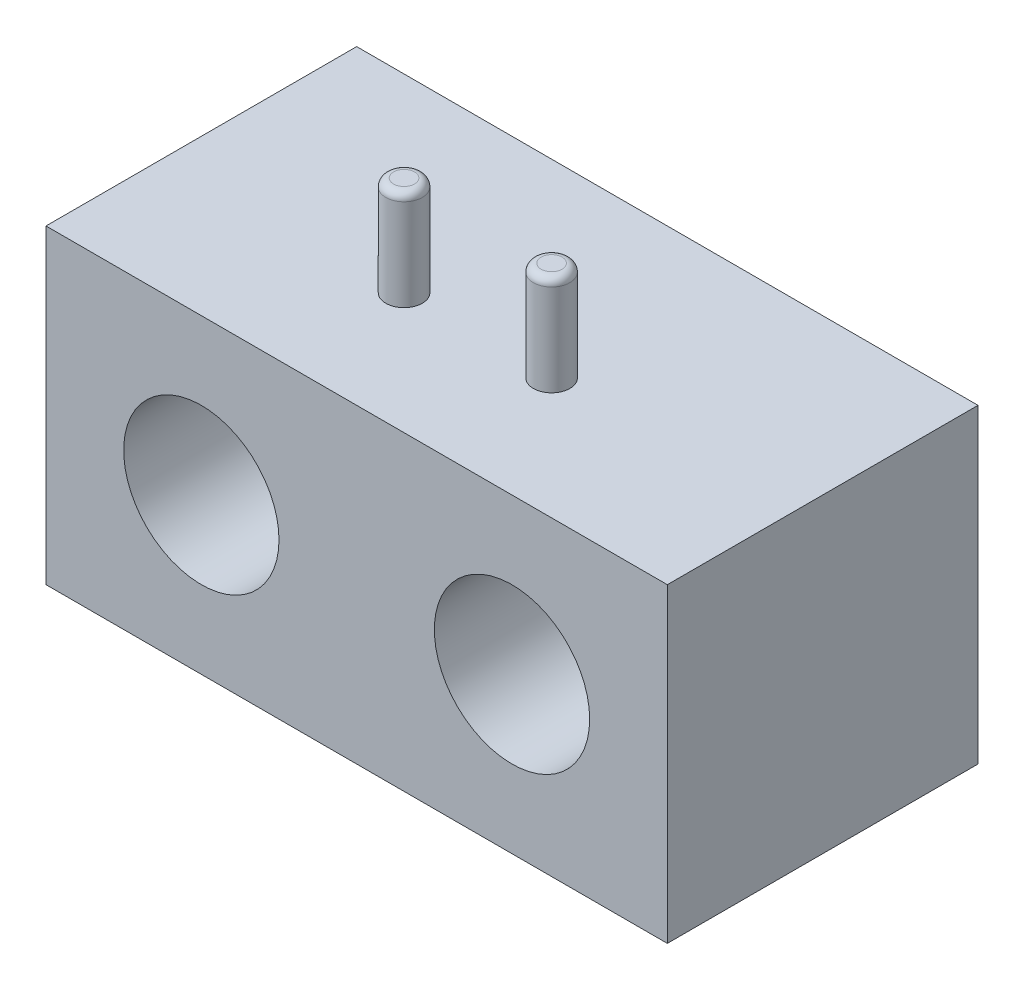
from build123d import *

# Parameters (mm, degrees)
SKETCH1_W           = 40
SKETCH1_H           = 20
SKETCH1_R           = 2.5
BOSS_EXTRUDE1_DEPTH = 20
SKETCH2_R           = 5
CUT_EXTRUDE1_DEPTH  = 18
SKETCH4_R           = 1.175
BOSS_EXTRUDE2_DEPTH = 6.4
FILLET1_R           = 0.5


with BuildPart() as part:
    # Sketch1 → Boss-Extrude1 (new body)
    with BuildSketch(Plane.XY):
        with Locations((5.224, 11.36)):
            Rectangle(SKETCH1_W, SKETCH1_H)
        with Locations((-4.776, 11.36)):
            Circle(SKETCH1_R, mode=Mode.SUBTRACT)
        with Locations((15.224, 11.36)):
            Circle(SKETCH1_R, mode=Mode.SUBTRACT)
    extrude(amount=BOSS_EXTRUDE1_DEPTH)

    # Sketch2 → Cut-Extrude1 (cut)
    with BuildSketch(Plane.XY.offset(20)):
        with Locations((-4.776, 11.36)):
            Circle(SKETCH2_R)
        with Locations((15.224, 11.36)):
            Circle(SKETCH2_R)
    extrude(amount=-CUT_EXTRUDE1_DEPTH, mode=Mode.SUBTRACT)

    # Sketch4 → Boss-Extrude2 (add)
    with BuildSketch(Plane(origin=(0, 21.36, 0), x_dir=(1, 0, 0), z_dir=(0, 1, 0))):
        with Locations(Location((9.974, -12.2, 0), (0, 0, 90))):
            Circle(SKETCH4_R)
        with Locations(Location((0.474, -12.2, 0), (0, 0, 90))):
            Circle(SKETCH4_R)
    extrude(amount=BOSS_EXTRUDE2_DEPTH)

    # Fillet1
    fillet1_edges = [part.edges().sort_by_distance(p)[0] for p in [
        (9.974, 27.76, 13.375),
        (0.474, 27.76, 13.375),
    ]]
    fillet(fillet1_edges, radius=FILLET1_R)


solid = part.part
